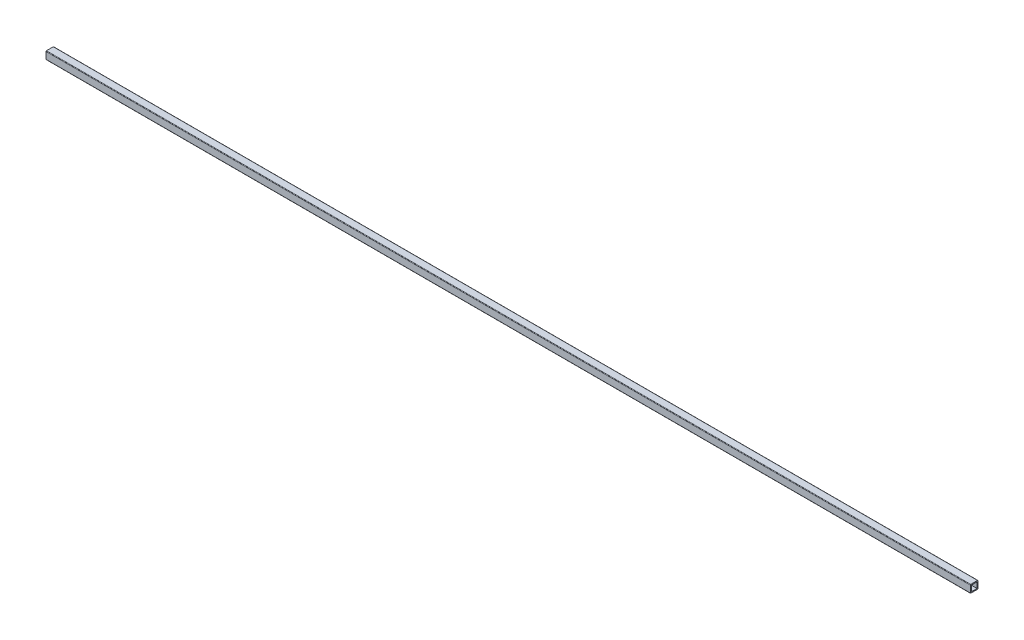
from build123d import *

# Parameters (mm, degrees)
SKETCH11_W               = 9.398
SKETCH11_H               = 9.398
STRUCTURAL_MEMBER1_DEPTH = 1524


with BuildPart() as part:
    # Sketch11 → Structural Member1 (new body)
    with BuildSketch(Plane.YZ):
        with BuildLine():
            Line((-5.55625, 6.35), (5.55625, 6.35))
            ThreePointArc((5.55625, 6.35), (6.117516008, 6.117516008), (6.35, 5.55625))
            Line((6.35, 5.55625), (6.35, -5.55625))
            ThreePointArc((6.35, -5.55625), (6.117516008, -6.117516008), (5.55625, -6.35))
            Line((5.55625, -6.35), (-5.55625, -6.35))
            ThreePointArc((-5.55625, -6.35), (-6.117516008, -6.117516008), (-6.35, -5.55625))
            Line((-6.35, -5.55625), (-6.35, 5.55625))
            ThreePointArc((-6.35, 5.55625), (-6.117516008, 6.117516008), (-5.55625, 6.35))
        make_face()
        Rectangle(SKETCH11_W, SKETCH11_H, mode=Mode.SUBTRACT)
    extrude(amount=STRUCTURAL_MEMBER1_DEPTH)


solid = part.part
